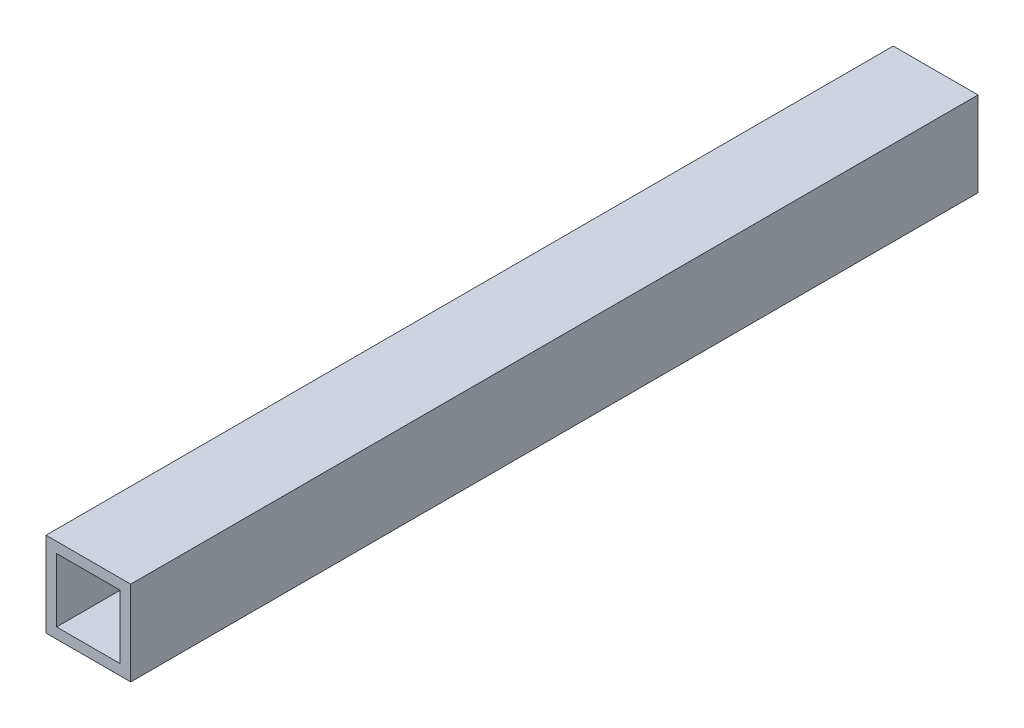
from build123d import *

# Parameters (mm, degrees)
BOSS_EXTRUDE1_DEPTH      = 127
BOSS_EXTRUDE1_DEPTH_BACK = 127
SKETCH3_W                = 25.4
SKETCH3_H                = 25.4
SKETCH3_W_2              = 19.05
SKETCH3_H_2              = 19.05


with BuildPart() as part:
    # Sketch3 → Boss-Extrude1 (new, two sides: drawn at the far end of the back side and taken through both)
    with BuildSketch(Plane.XY.offset(-BOSS_EXTRUDE1_DEPTH_BACK)):
        Rectangle(SKETCH3_W, SKETCH3_H)
        Rectangle(SKETCH3_W_2, SKETCH3_H_2, mode=Mode.SUBTRACT)
    extrude(amount=BOSS_EXTRUDE1_DEPTH + BOSS_EXTRUDE1_DEPTH_BACK)


solid = part.part
